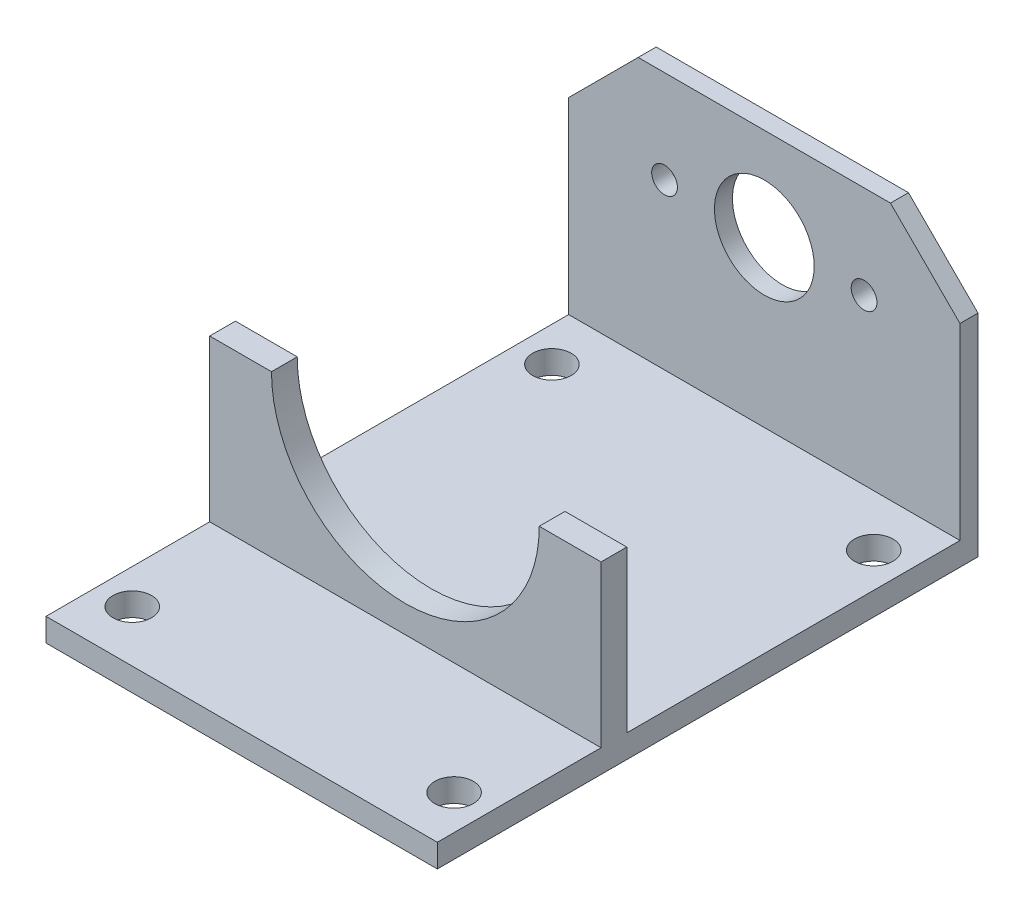
from build123d import *

# Parameters (mm, degrees)
SKETCH1_W           = 30.4
SKETCH1_H           = 42
BOSS_EXTRUDE1_DEPTH = 1.8
SKETCH2_W           = 30.4
SKETCH2_H           = 1.4
BOSS_EXTRUDE2_DEPTH = 20
SKETCH3_R           = 1.5
CUT_EXTRUDE1_DEPTH  = 20
SKETCH4_R           = 3.875
SKETCH4_R_2         = 1
CUT_EXTRUDE2_DEPTH  = 20
SKETCH5_W           = 30.4
SKETCH5_H           = 2
BOSS_EXTRUDE3_DEPTH = 12.5
SKETCH6_R           = 10.4
CUT_EXTRUDE3_DEPTH  = 10


with BuildPart() as part:
    # Sketch1 → Boss-Extrude1 (new body)
    with BuildSketch(Plane(origin=(0, 0, 0), x_dir=(1, 0, 0), z_dir=(0, 1, 0))):
        Rectangle(SKETCH1_W, SKETCH1_H)
    extrude(amount=BOSS_EXTRUDE1_DEPTH)

    # Sketch2 → Boss-Extrude2 (add)
    with BuildSketch(Plane(origin=(0, 1.8, 0), x_dir=(1, 0, 0), z_dir=(0, 1, 0))):
        with Locations((0, 20.3)):
            Rectangle(SKETCH2_W, SKETCH2_H)
    extrude(amount=BOSS_EXTRUDE2_DEPTH)

    # Sketch3 → Cut-Extrude1 (cut)
    with BuildSketch(Plane(origin=(0, 1.8, 0), x_dir=(1, 0, 0), z_dir=(0, 1, 0))):
        with Locations(Location((12.5, 15.6, 0), (0, 0, 270))):
            Circle(SKETCH3_R)
        with Locations(Location((-12.5, 15.6, 0), (0, 0, 270))):
            Circle(SKETCH3_R)
        with Locations(Location((-12.5, -17, 0), (0, 0, 270))):
            Circle(SKETCH3_R)
        with Locations(Location((12.5, -17, 0), (0, 0, 270))):
            Circle(SKETCH3_R)
    extrude(amount=-CUT_EXTRUDE1_DEPTH, mode=Mode.SUBTRACT)

    # Sketch4 → Cut-Extrude2 (cut)
    with BuildSketch(Plane.XY.offset(-19.6)):
        with Locations((0, 14.58)):
            Circle(SKETCH4_R)
        with Locations((-7.75, 14.58)):
            Circle(SKETCH4_R_2)
        with Locations((7.75, 14.58)):
            Circle(SKETCH4_R_2)
        Polygon((-15.2, 16.4), (-9.8, 21.8), (-15.2, 21.8), align=None)
        Polygon((15.2, 16.4), (15.2, 21.8), (9.8, 21.8), align=None)
    extrude(amount=-CUT_EXTRUDE2_DEPTH, mode=Mode.SUBTRACT)

    # Sketch5 → Boss-Extrude3 (add)
    with BuildSketch(Plane(origin=(0, 1.8, 0), x_dir=(1, 0, 0), z_dir=(0, 1, 0))):
        with Locations((0, -7.283746966)):
            Rectangle(SKETCH5_W, SKETCH5_H)
    extrude(amount=BOSS_EXTRUDE3_DEPTH)

    # Sketch6 → Cut-Extrude3 (cut)
    with BuildSketch(Plane.XY.offset(8.283746966)):
        with Locations((0, 14.3)):
            Circle(SKETCH6_R)
    extrude(amount=-CUT_EXTRUDE3_DEPTH, mode=Mode.SUBTRACT)


solid = part.part
